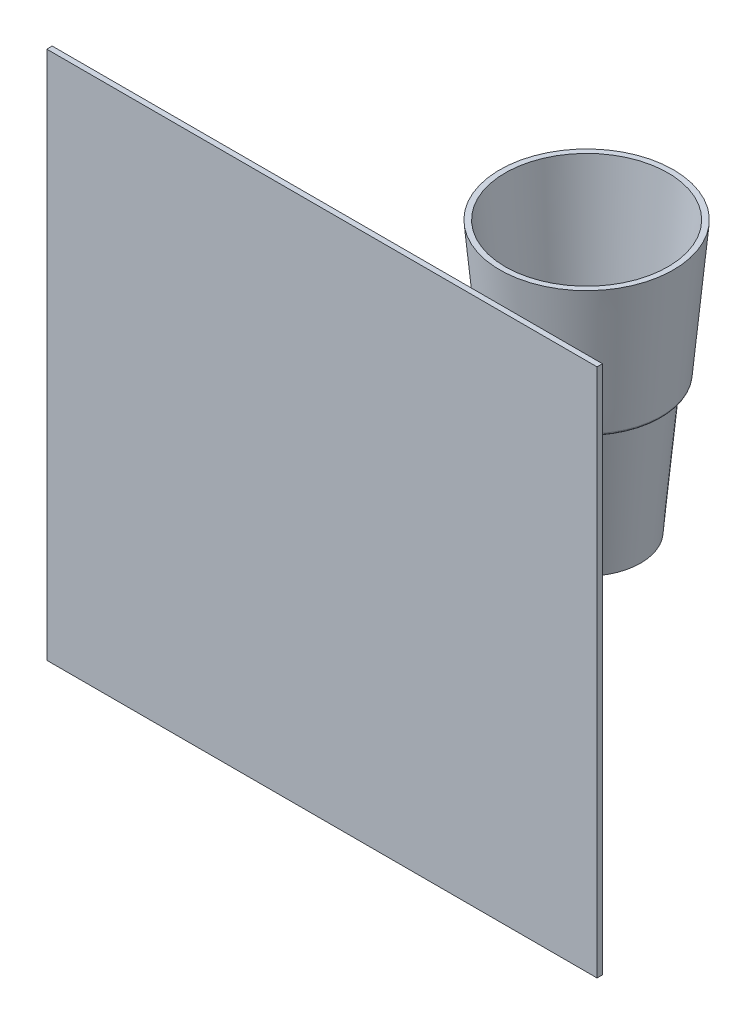
from build123d import *

# Parameters (mm, degrees)
FILLET1_R           = 1.27
SHELL1_T            = -2.54
SKETCH2_W           = 258.519296789
SKETCH2_H           = 248.652148056
BOSS_EXTRUDE1_DEPTH = 2.54


with BuildPart() as part:
    # Sketch1 → Revolve2 (revolve)
    with BuildSketch(Plane.XY, mode=Mode.PRIVATE) as revolve2_sk:
        Polygon((0, 0), (25.4, 0), (31.185877256, 63.5), (34.995877256, 63.5), (40.781754513, 127), (0, 127), align=None)
    revolve(revolve2_sk.sketch.rotate(Axis((0, 0, 0), (0, 1, 0)), 90), axis=Axis((0, 0, 0), (0, 1, 0)))

    # Fillet1
    fillet1_edges = [part.edges().sort_by_distance(p)[0] for p in [
        (0, 63.5, 34.995877256),
        (0, 63.5, 31.185877256),
    ]]
    fillet(fillet1_edges, radius=FILLET1_R)

    # Shell1
    shell1_openings = [part.faces().sort_by_distance(p)[0] for p in [
        (0, 127, 0),
    ]]
    offset(amount=SHELL1_T, openings=shell1_openings, kind=Kind.INTERSECTION)


with BuildPart() as body_2:
    # Sketch2 → Boss-Extrude1 (new body)
    with BuildSketch(Plane.XY.offset(127)):
        with Locations((5.180253085, 74.847221042)):
            Rectangle(SKETCH2_W, SKETCH2_H)
    extrude(amount=BOSS_EXTRUDE1_DEPTH)


solid = Compound([part.part, body_2.part])
